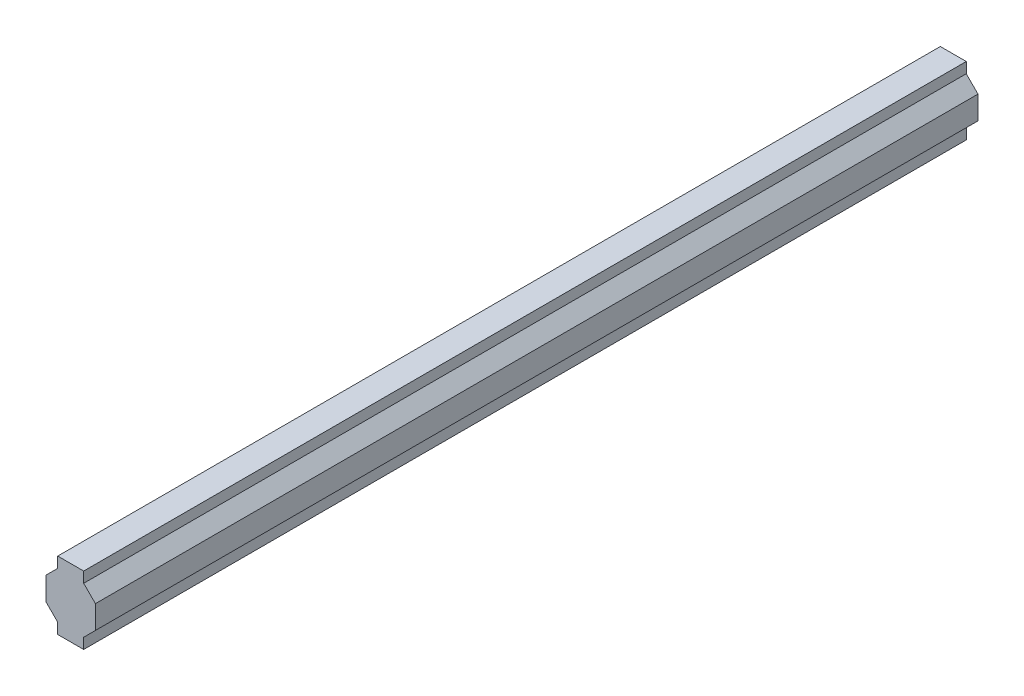
from build123d import *

# Parameters (mm, degrees)
BOSS_EXTRUDE1_DEPTH = 200


with BuildPart() as part:
    # Sketch1 → Boss-Extrude1 (new body)
    with BuildSketch(Plane.XY.offset(116.106580091)):
        Polygon((-39.550290087, 5.294235639), (-36.889629915, 7.954895811), (-36.889629915, 10.362002592), (-31.010950259, 10.362002592), (-31.010950259, 7.954895811), (-28.350290087, 5.294235639), (-28.350290087, 0.029769545), (-31.010950259, -2.630890626), (-31.010950259, -5.037997408), (-36.889629915, -5.037997408), (-36.889629915, -2.630890626), (-39.550290087, 0.029769545), align=None)
    extrude(amount=BOSS_EXTRUDE1_DEPTH)


solid = part.part
